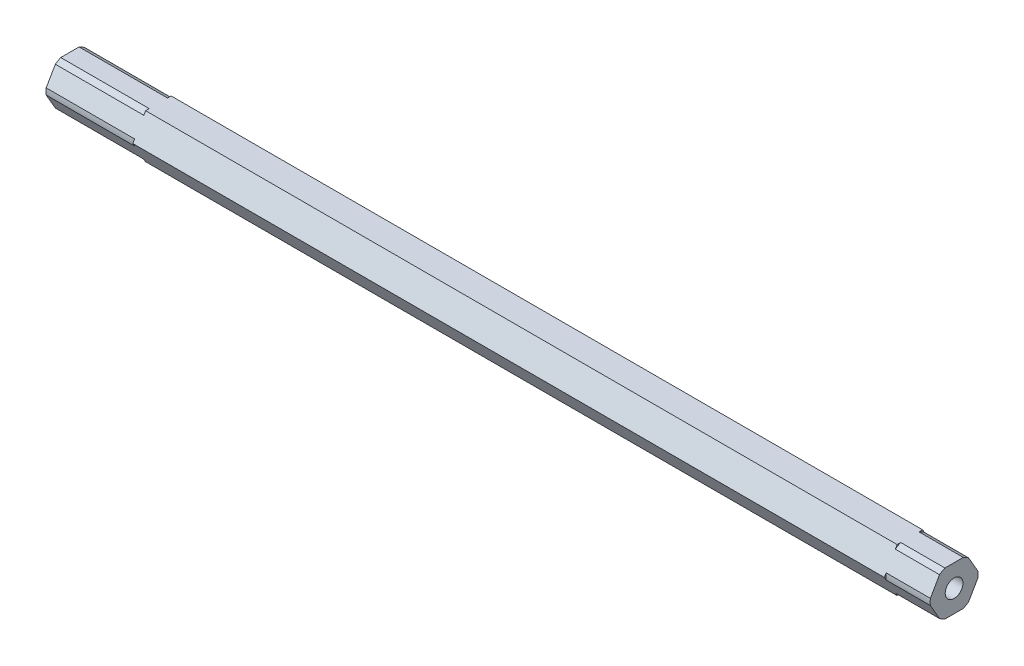
from build123d import *

# Parameters (mm, degrees)
SKETCH1_R           = 2.5527
BOSS_EXTRUDE1_DEPTH = 127
SKETCH2_OUTSIDE_W   = 67.612
SKETCH2_OUTSIDE_H   = 65.648
SKETCH2_OUTSIDE_R   = 6.875
CUT_EXTRUDE1_DEPTH  = 25.4
SKETCH3_OUTSIDE_W   = 67.612
SKETCH3_OUTSIDE_H   = 65.648
SKETCH3_OUTSIDE_R   = 6.875
CUT_EXTRUDE2_DEPTH  = 12.7


with BuildPart() as part:
    # Sketch1 → Boss-Extrude1 (new, symmetric)
    with BuildSketch(Plane(origin=(0, 0, 0), x_dir=(0, 0, -1), z_dir=(1, 0, 0))):
        Polygon((3.666174209, -6.35), (7.332348419, 0), (3.666174209, 6.35), (-3.666174209, 6.35), (-7.332348419, 0), (-3.666174209, -6.35), align=None)
        Circle(SKETCH1_R, mode=Mode.SUBTRACT)
    extrude(amount=BOSS_EXTRUDE1_DEPTH, both=True)

    # Sketch2 outside → Cut-Extrude1 (cut)
    with BuildSketch(Plane.ZY.offset(127)):
        Rectangle(SKETCH2_OUTSIDE_W, SKETCH2_OUTSIDE_H)
        Circle(SKETCH2_OUTSIDE_R, mode=Mode.SUBTRACT)
    extrude(amount=-CUT_EXTRUDE1_DEPTH, mode=Mode.SUBTRACT)

    # Sketch3 outside → Cut-Extrude2 (cut)
    with BuildSketch(Plane(origin=(127, 0, 0), x_dir=(0, 0, -1), z_dir=(1, 0, 0))):
        Rectangle(SKETCH3_OUTSIDE_W, SKETCH3_OUTSIDE_H)
        Circle(SKETCH3_OUTSIDE_R, mode=Mode.SUBTRACT)
    extrude(amount=-CUT_EXTRUDE2_DEPTH, mode=Mode.SUBTRACT)


solid = part.part
